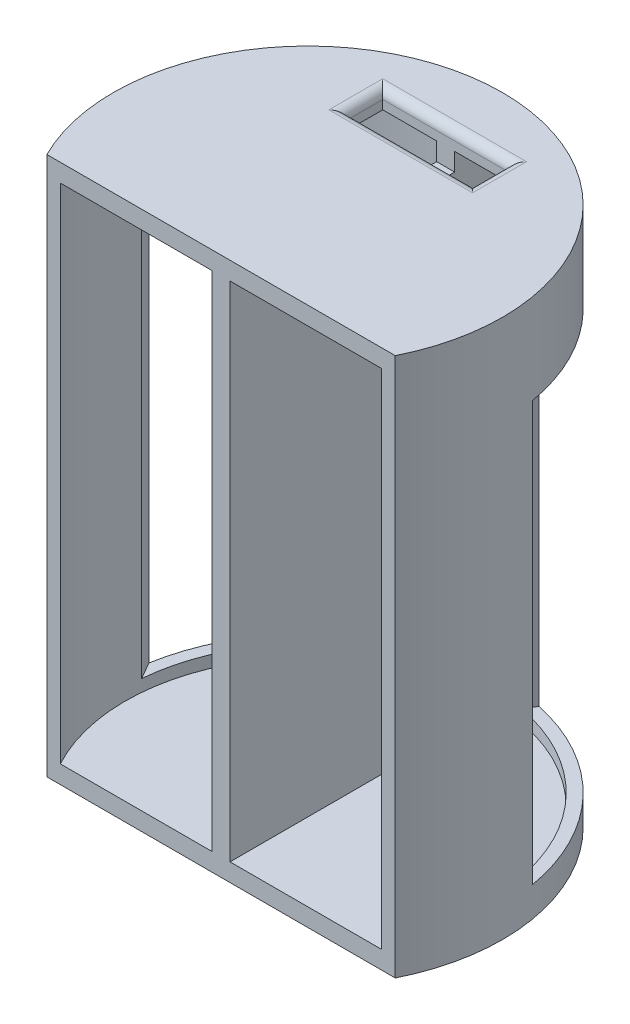
from build123d import *

# Parameters (mm, degrees)
SKETCH1_R                       = 32.5
SKETCH1_R_2                     = 30.5
CYLINDER_BULK_EXTRUDE_DEPTH     = 90
TOP_START                       = -3
SKETCH2_R                       = 32.5
TOP_LID_DEPTH                   = 3
SKETCH3_R                       = 32.5
BOTTOM_LID_DEPTH                = 3
REAR_ACCESS_CUT_DEPTH           = 102.056914657
REAR_ACCESS_CUT_DEPTH_BACK      = 102.056914657
SKETCH5_W                       = 58.172158288
SKETCH5_H                       = 18
SKETCH8_W                       = 70
SKETCH8_H                       = 35
WEIGHT_RELIEF_PT1_DEPTH         = 102.056914657
CENTER_STIFFNESS_RIB_REACH      = 108.608
CENTER_STIFFNESS_RIB_END_RADIUS = 30.5
SKETCH6_W                       = 3
SKETCH6_H                       = 90
ALIGNMENT_SLOT_CUT_DEPTH        = 102.056914657
ALIGNMENT_SLOT_CUT_DEPTH_BACK   = 6
SKETCH4_W                       = 21
SKETCH4_H                       = 6
FILLET1_R                       = 1.5
SKETCH9_W                       = 20
SKETCH9_H                       = 5
ALIGNMENT_PEG_DEPTH             = 5
FILLET2_R                       = 1


with BuildPart() as part:
    # Sketch1 → CYLINDER BULK EXTRUDE (new body)
    with BuildSketch(Plane(origin=(0, 0, 0), x_dir=(1, 0, 0), z_dir=(0, 1, 0))):
        with Locations(Location((0, 0, 0), (0, 0, 90))):
            Circle(SKETCH1_R)
        with Locations(Location((0, 0, 0), (0, 0, 90))):
            Circle(SKETCH1_R_2, mode=Mode.SUBTRACT)
    extrude(amount=CYLINDER_BULK_EXTRUDE_DEPTH)

    # Sketch2 → TOP LID (add)
    with BuildSketch(Plane(origin=(0, 90, 0), x_dir=(1, 0, 0), z_dir=(0, 1, 0)).offset(TOP_START)):
        with Locations(Location((0, 0, 0), (0, 0, 90))):
            Circle(SKETCH2_R)
    extrude(amount=TOP_LID_DEPTH)

    # Sketch3 → BOTTOM LID (add)
    with BuildSketch(Plane.XZ):
        with Locations(Location((0, 0, 0), (0, 0, 270))):
            Circle(SKETCH3_R)
    extrude(amount=-BOTTOM_LID_DEPTH)

    # Sketch5 → REAR ACCESS CUT (cut, two sides: drawn at the far end of the back side and taken through both)
    with BuildSketch(Plane(origin=(0, 90, 0), x_dir=(1, 0, 0), z_dir=(0, 1, 0)).offset(-REAR_ACCESS_CUT_DEPTH_BACK)):
        with Locations((0, -23.5)):
            Rectangle(SKETCH5_W, SKETCH5_H)
    extrude(amount=REAR_ACCESS_CUT_DEPTH + REAR_ACCESS_CUT_DEPTH_BACK, mode=Mode.SUBTRACT)

    # Sketch8 → WEIGHT RELIEF PT1 (cut, symmetric)
    with BuildSketch(Plane(origin=(0, 0, 0), x_dir=(0, 1, 0), z_dir=(0.499999999999998, 0, -0.8660254037844398))):
        with Locations((40, 7.5)):
            Rectangle(SKETCH8_W, SKETCH8_H)
    weight_relief_pt1 = extrude(amount=WEIGHT_RELIEF_PT1_DEPTH, both=True, mode=Mode.SUBTRACT)

    # WEIGHT RELIEF PT2: WEIGHT RELIEF PT1 across plane
    add(weight_relief_pt1.mirror(Plane(origin=(0, 0, 0), x_dir=(0, 0, 1), z_dir=(1, 0, 0))), mode=Mode.SUBTRACT)

    # CENTER STIFFNESS RIB: up to this cylinder (the profile starts inside it)
    center_stiffness_rib_end = Plane(origin=(0, 45, 0), z_dir=(0, -1, 0)) * Cylinder(CENTER_STIFFNESS_RIB_END_RADIUS, 279.216, mode=Mode.PRIVATE)
    # Sketch6 → CENTER STIFFNESS RIB (add, up to the surface)
    with BuildSketch(Plane.XY.offset(14.5), mode=Mode.PRIVATE) as center_stiffness_rib_sk1:
        with Locations((0, 45)):
            Rectangle(SKETCH6_W, SKETCH6_H)
    center_stiffness_rib_tool1 = extrude(center_stiffness_rib_sk1.sketch, amount=-CENTER_STIFFNESS_RIB_REACH, mode=Mode.PRIVATE) & center_stiffness_rib_end
    add(center_stiffness_rib_tool1.solids().sort_by_distance((0, 45, 14.5))[0])

    # Sketch4 → ALIGNMENT SLOT CUT (cut, two sides: drawn at the far end of the back side and taken through both)
    with BuildSketch(Plane(origin=(0, 90, 0), x_dir=(1, 0, 0), z_dir=(0, 1, 0)).offset(-ALIGNMENT_SLOT_CUT_DEPTH_BACK)):
        with Locations((0, 20)):
            Rectangle(SKETCH4_W, SKETCH4_H)
    extrude(amount=ALIGNMENT_SLOT_CUT_DEPTH + ALIGNMENT_SLOT_CUT_DEPTH_BACK, mode=Mode.SUBTRACT)

    # Fillet1
    fillet1_edges = [part.edges().sort_by_distance(p)[0] for p in [
        (10.5, 90, -20),
        (-10.5, 90, -20),
        (0, 90, -17),
        (0, 90, -23),
    ]]
    fillet(fillet1_edges, radius=FILLET1_R)

    # Sketch9 → ALIGNMENT PEG (add)
    with BuildSketch(Plane.XZ):
        with Locations((0, -20)):
            Rectangle(SKETCH9_W, SKETCH9_H)
    extrude(amount=ALIGNMENT_PEG_DEPTH)

    # Fillet2
    fillet2_edges = [part.edges().sort_by_distance(p)[0] for p in [
        (-10, 0, -20),
        (0, 0, -22.5),
        (10, 0, -20),
        (0, 0, -17.5),
    ]]
    fillet(fillet2_edges, radius=FILLET2_R)


solid = part.part
